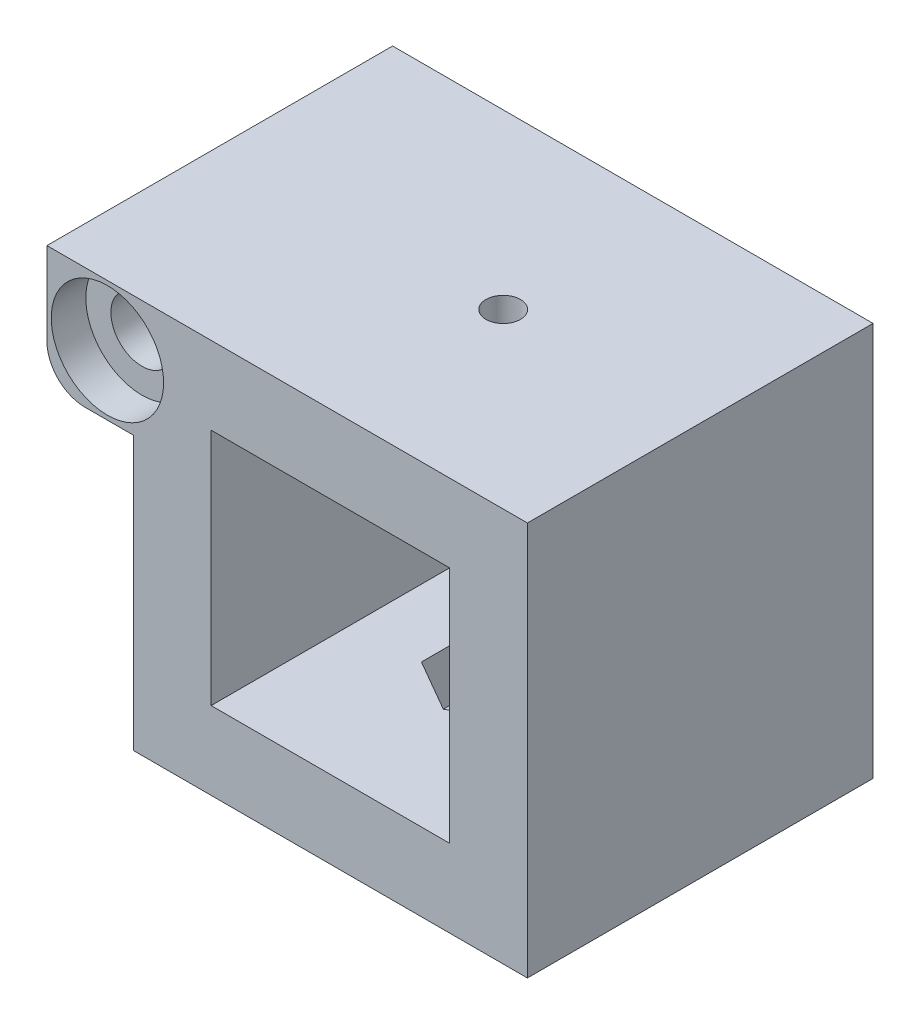
from build123d import *

# Parameters (mm, degrees)
CROQUIS1_W                                           = 22.8
CROQUIS1_H                                           = 22.8
CROQUIS1_W_2                                         = 13.8
CROQUIS1_H_2                                         = 13.8
SALIENTE_EXTRUIR1_DEPTH                              = 10
CORTAR_EXTRUIR1_DEPTH                                = 3
CROQUIS3_R                                           = 1.75
CORTAR_EXTRUIR2_DEPTH                                = 3
SALIENTE_EXTRUIR3_DEPTH                              = 20
CROQUIS8_R                                           = 1.75
CORTAR_EXTRUIR3_DEPTH                                = 4
REFRENTADO_PARA_TORNILLO_CON_CABEZA_PLAN_D           = 3.6
REFRENTADO_PARA_TORNILLO_CON_CABEZA_PLAN_CBORE_D     = 6.5
REFRENTADO_PARA_TORNILLO_CON_CABEZA_PLAN_CBORE_DEPTH = 2
REDONDEO1_R                                          = 2.2
CROQUIS12_R                                          = 1
CORTAR_EXTRUIR5_DEPTH                                = 10


with BuildPart() as part:
    # Croquis1 → Saliente-Extruir1 (new, symmetric)
    with BuildSketch(Plane.XY):
        Rectangle(CROQUIS1_W, CROQUIS1_H)
        Rectangle(CROQUIS1_W_2, CROQUIS1_H_2, mode=Mode.SUBTRACT)
    extrude(amount=SALIENTE_EXTRUIR1_DEPTH, both=True)

    # Croquis2 → Cortar-Extruir1 (cut)
    with BuildSketch(Plane(origin=(0, -6.9, 0), x_dir=(1, 0, 0), z_dir=(0, 1, 0))):
        Polygon((3, -1.732050808), (3, 1.732050808), (0, 3.464101615), (-3, 1.732050808), (-3, -1.732050808), (0, -3.464101615), align=None)
    extrude(amount=-CORTAR_EXTRUIR1_DEPTH, mode=Mode.SUBTRACT)

    # Croquis3 → Cortar-Extruir2 (cut)
    with BuildSketch(Plane(origin=(0, -9.9, 0), x_dir=(1, 0, 0), z_dir=(0, 1, 0))):
        with Locations(Location((0, 0, 0), (0, 0, 270))):
            Circle(CROQUIS3_R)
    extrude(amount=-CORTAR_EXTRUIR2_DEPTH, mode=Mode.SUBTRACT)

    # Croquis4 → Saliente-Extruir3 (add, through all)
    with BuildSketch(Plane(origin=(0, 0, -10), x_dir=(-1, 0, 0), z_dir=(0, 0, -1))):
        with BuildLine():
            Line((16.4, 11.4), (12.9, 11.4))
            Line((12.9, 11.4), (12.9, 9.5))
            ThreePointArc((12.9, 9.5), (14.03137085, 9.03137085), (14.5, 7.9))
            ThreePointArc((14.5, 7.9), (14.03137085, 6.76862915), (12.9, 6.3))
            Line((12.9, 6.3), (12.9, 4.4))
            Line((12.9, 4.4), (16.4, 4.4))
            Line((16.4, 4.4), (16.4, 11.4))
        make_face()
        with BuildLine():
            Line((12.9, 4.4), (12.9, 6.3))
            ThreePointArc((12.9, 6.3), (11.986447127, 6.586447127), (11.4, 7.343223564))
            Line((11.4, 7.343223564), (11.4, 4.4))
            Line((11.4, 4.4), (12.9, 4.4))
        make_face()
        with BuildLine():
            Line((12.9, 9.5), (12.9, 11.4))
            Line((12.9, 11.4), (11.4, 11.4))
            Line((11.4, 11.4), (11.4, 8.456776436))
            ThreePointArc((11.4, 8.456776436), (11.986447127, 9.213552873), (12.9, 9.5))
        make_face()
    extrude(amount=-SALIENTE_EXTRUIR3_DEPTH)

    # Croquis8 → Cortar-Extruir3 (cut)
    with BuildSketch(Plane(origin=(0, 0, -10), x_dir=(-1, 0, 0), z_dir=(0, 0, -1))):
        with Locations((12.9, 7.9)):
            Circle(CROQUIS8_R)
    extrude(amount=-CORTAR_EXTRUIR3_DEPTH, mode=Mode.SUBTRACT)

    # Refrentado para tornillo con cabeza plana de M31 (through all)
    with Locations(Plane(origin=(-12.9, 7.9, 10), x_dir=(1, 0, 0), z_dir=(0, 0, 1))):
        with Locations((0, 0)):
            CounterBoreHole(REFRENTADO_PARA_TORNILLO_CON_CABEZA_PLAN_D / 2, REFRENTADO_PARA_TORNILLO_CON_CABEZA_PLAN_CBORE_D / 2, REFRENTADO_PARA_TORNILLO_CON_CABEZA_PLAN_CBORE_DEPTH)

    # Redondeo1
    redondeo1_edges = [part.edges().sort_by_distance(p)[0] for p in [
        (-16.4, 4.4, 0),
    ]]
    fillet(redondeo1_edges, radius=REDONDEO1_R)

    # Croquis12 → Cortar-Extruir5 (cut)
    with BuildSketch(Plane(origin=(0, 11.4, 0), x_dir=(1, 0, 0), z_dir=(0, 1, 0))):
        with Locations(Location((0, 0, 0), (0, 0, 270))):
            Circle(CROQUIS12_R)
    extrude(amount=-CORTAR_EXTRUIR5_DEPTH, mode=Mode.SUBTRACT)


solid = part.part
